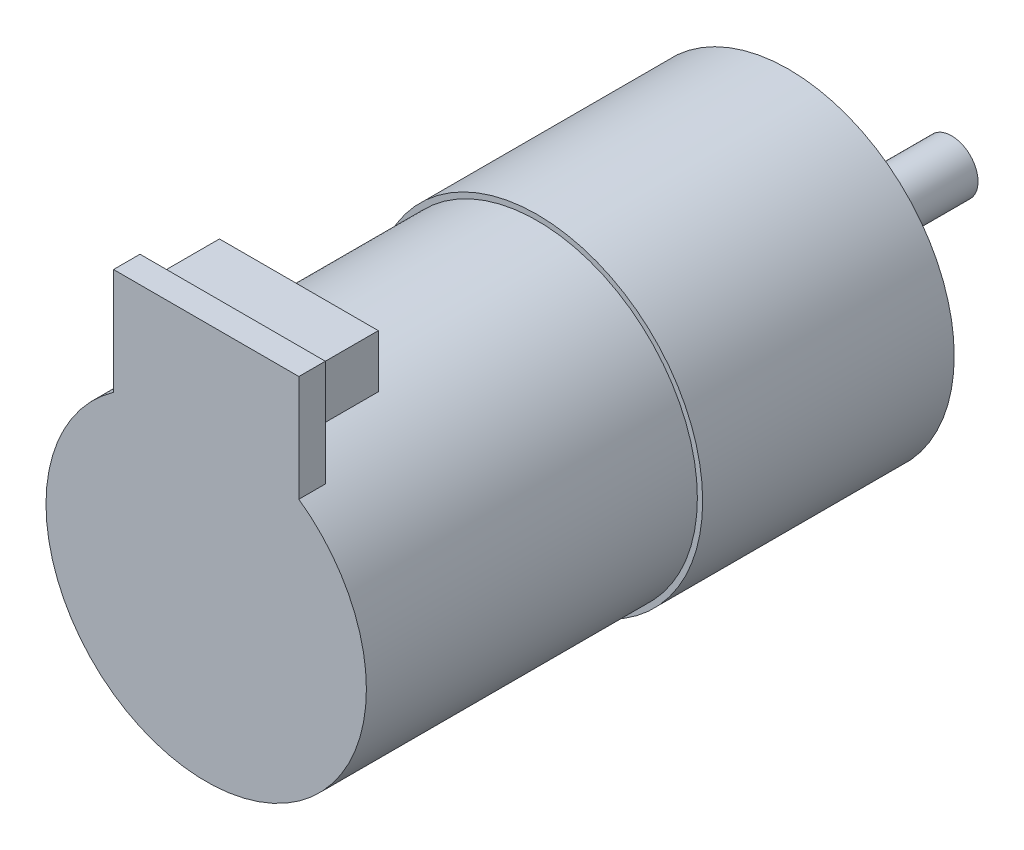
from build123d import *

# Parameters (mm, degrees)
SKETCH1_R           = 12.5
BOSS_EXTRUDE1_DEPTH = 19
SKETCH2_R           = 12.1
BOSS_EXTRUDE2_DEPTH = 23
BOSS_EXTRUDE3_DEPTH = 2
SKETCH4_W           = 12
SKETCH4_H           = 4
BOSS_EXTRUDE4_DEPTH = 5
SKETCH5_R           = 3.5
BOSS_EXTRUDE5_DEPTH = 2.7
SKETCH6_R           = 2
BOSS_EXTRUDE6_DEPTH = 12.3
SKETCH7_R           = 1.5
CUT_EXTRUDE1_DEPTH  = 5


with BuildPart() as part:
    # Sketch1 → Boss-Extrude1 (new body)
    with BuildSketch(Plane.XY):
        Circle(SKETCH1_R)
    extrude(amount=BOSS_EXTRUDE1_DEPTH)

    # Sketch2 → Boss-Extrude2 (add)
    with BuildSketch(Plane.XY.offset(19)):
        Circle(SKETCH2_R)
    extrude(amount=BOSS_EXTRUDE2_DEPTH)

    # Sketch3 → Boss-Extrude3 (add)
    with BuildSketch(Plane.XY.offset(42)):
        with BuildLine():
            Line((-7, 17.9), (7, 17.9))
            Line((7, 17.9), (7, 9.86965045))
            ThreePointArc((7, 9.86965045), (0, -12.1), (-7, 9.86965045))
            Line((-7, 9.86965045), (-7, 17.9))
        make_face()
    extrude(amount=BOSS_EXTRUDE3_DEPTH)

    # Sketch4 → Boss-Extrude4 (add)
    with BuildSketch(Plane(origin=(0, 0, 42), x_dir=(-1, 0, 0), z_dir=(0, 0, -1))):
        with Locations((0, 14.9)):
            Rectangle(SKETCH4_W, SKETCH4_H)
    extrude(amount=BOSS_EXTRUDE4_DEPTH)

    # Sketch5 → Boss-Extrude5 (add)
    with BuildSketch(Plane(origin=(0, 0, 0), x_dir=(-1, 0, 0), z_dir=(0, 0, -1))):
        with Locations(Location((0, 0, 0), (0, 0, 180))):
            Circle(SKETCH5_R)
    extrude(amount=BOSS_EXTRUDE5_DEPTH)

    # Sketch6 → Boss-Extrude6 (add)
    with BuildSketch(Plane(origin=(0, 0, 0), x_dir=(-1, 0, 0), z_dir=(0, 0, -1))):
        Circle(SKETCH6_R)
    extrude(amount=BOSS_EXTRUDE6_DEPTH)

    # Sketch7 → Cut-Extrude1 (cut)
    with BuildSketch(Plane(origin=(0, 0, 0), x_dir=(-1, 0, 0), z_dir=(0, 0, -1))):
        with Locations((10, 0)):
            Circle(SKETCH7_R)
        with Locations((-10, 0)):
            Circle(SKETCH7_R)
    extrude(amount=-CUT_EXTRUDE1_DEPTH, mode=Mode.SUBTRACT)


solid = part.part
